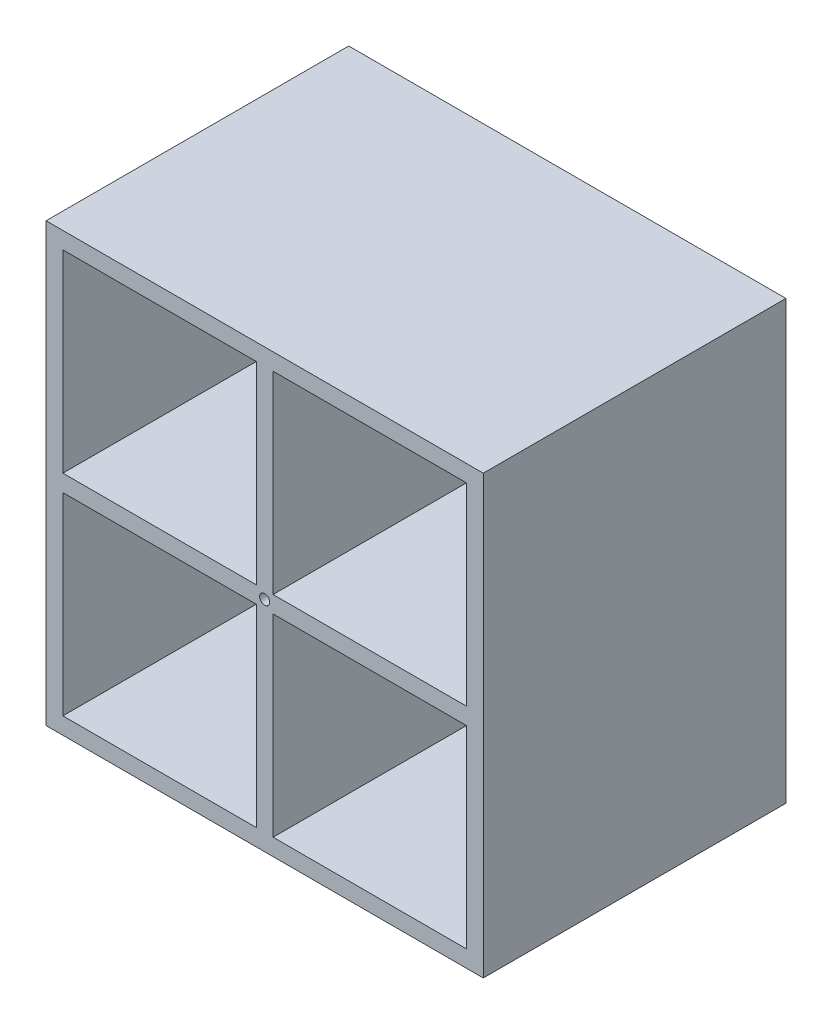
from build123d import *

# Parameters (mm, degrees)
SKICA1_W                 = 130
SKICA1_H                 = 130
P_IDAT_VYSUNUT_M1_DEPTH  = 90
SKICA3_W                 = 57.5
SKICA3_H                 = 57.5
ODEBRAT_VYSUNUT_M1_DEPTH = 90
SKICA4_R                 = 1.5
ODEBRAT_VYSUNUT_M2_DEPTH = 90


with BuildPart() as part:
    # Skica1 → Přidat vysunutím1 (new body)
    with BuildSketch(Plane.XY):
        Rectangle(SKICA1_W, SKICA1_H)
    extrude(amount=P_IDAT_VYSUNUT_M1_DEPTH)

    # Skica3 → Odebrat vysunutím1 (cut)
    with BuildSketch(Plane.XY.offset(90)):
        with Locations((-31.25, 31.25)):
            Rectangle(SKICA3_W, SKICA3_H)
        with Locations((31.25, 31.25)):
            Rectangle(SKICA3_W, SKICA3_H)
        with Locations((-31.25, -31.25)):
            Rectangle(SKICA3_W, SKICA3_H)
        with Locations((31.25, -31.25)):
            Rectangle(SKICA3_W, SKICA3_H)
    extrude(amount=-ODEBRAT_VYSUNUT_M1_DEPTH, mode=Mode.SUBTRACT)

    # Skica4 → Odebrat vysunutím2 (cut)
    with BuildSketch(Plane.XY.offset(90)):
        Circle(SKICA4_R)
    extrude(amount=-ODEBRAT_VYSUNUT_M2_DEPTH, mode=Mode.SUBTRACT)


solid = part.part
